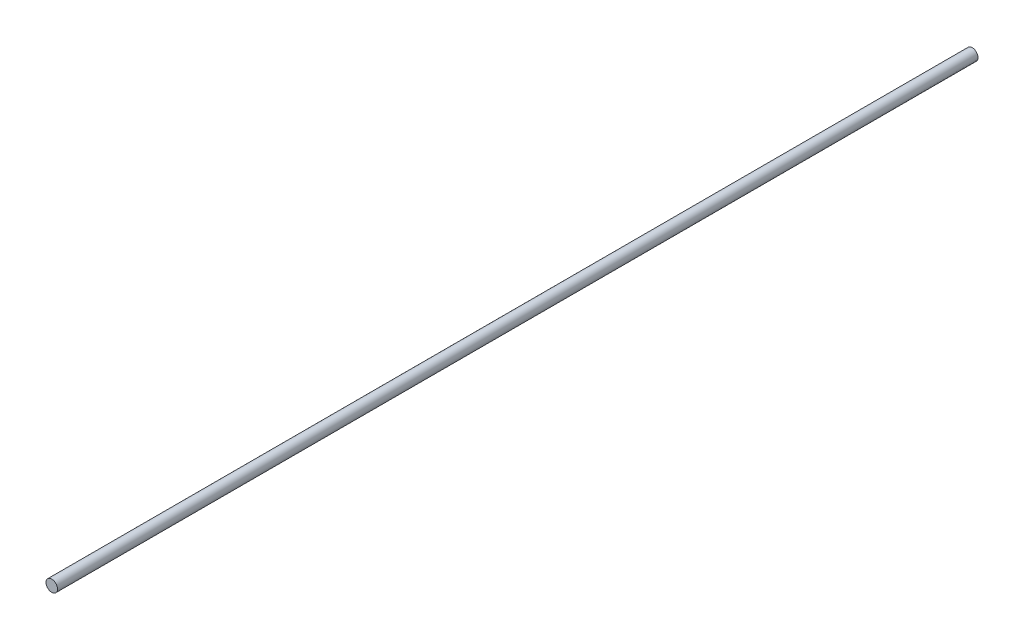
from build123d import *

# Parameters (mm, degrees)
SKETCH1_R           = 3.75
BOSS_EXTRUDE1_DEPTH = 600


with BuildPart() as part:
    # Sketch1 → Boss-Extrude1 (new body)
    with BuildSketch(Plane.XY):
        Circle(SKETCH1_R)
    extrude(amount=-BOSS_EXTRUDE1_DEPTH)


solid = part.part
